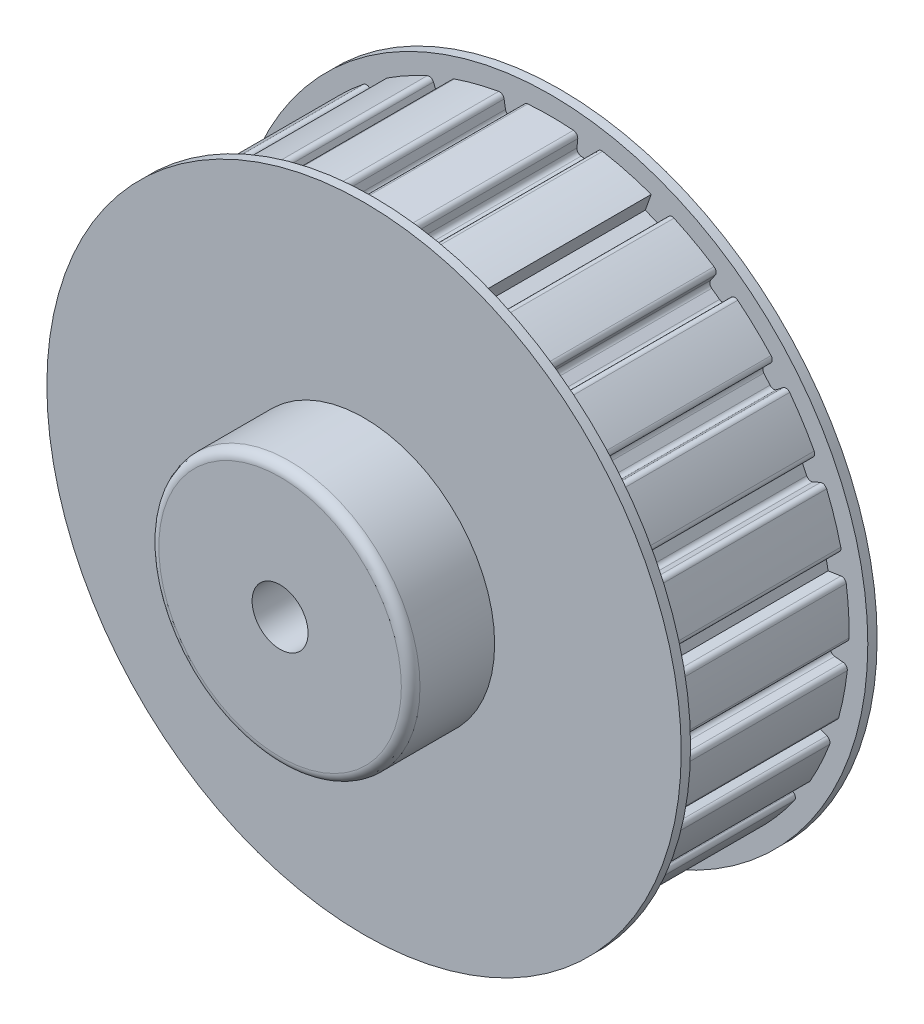
from build123d import *

# Parameters (mm, degrees)
SKETCH1_R               = 34
BOSS_EXTRUDE1_DEPTH     = 1
SKETCH4_R               = 32
BOSS_EXTRUDE2_DEPTH     = 19
CUT_EXTRUDE1_DEPTH      = 19
BOSS_EXTRUDE3_START     = -1
SKETCH9_R               = 34
BOSS_EXTRUDE3_DEPTH     = 1
SKETCH10_R              = 14
BOSS_EXTRUDE4_DEPTH     = 10
CUT_EXTRUDE2_DEPTH      = 53.076866265
CUT_EXTRUDE2_DEPTH_BACK = 53.076866265
SKETCH11_R              = 3
FILLET1_R               = 1
FILLET2_R               = 0.5
FILLET3_R               = 0.5


with BuildPart() as part:
    # Sketch1 → Boss-Extrude1 (new body)
    with BuildSketch(Plane.XY):
        Circle(SKETCH1_R)
    extrude(amount=BOSS_EXTRUDE1_DEPTH)

    # Sketch4 → Boss-Extrude2 (add)
    with BuildSketch(Plane.XY):
        Circle(SKETCH4_R)
    extrude(amount=-BOSS_EXTRUDE2_DEPTH)

    # Sketch8 → Cut-Extrude1 (cut)
    with BuildSketch(Plane.XY.offset(-19)):
        with BuildLine():
            Line((-1, -30.089853456), (-1.066467589, -32.089853456))
            ThreePointArc((-1.066467589, -32.089853456), (0, -32.107569948), (1.066467589, -32.089853456))
            Line((1.066467589, -32.089853456), (1, -30.089853456))
            Line((1, -30.089853456), (-1, -30.089853456))
        make_face()
        with BuildLine():
            Line((6.5144591, -29.393215266), (6.947459487, -31.346911405))
            ThreePointArc((6.947459487, -31.346911405), (7.984827948, -31.098851597), (9.013384583, -30.816471997))
            Line((9.013384583, -30.816471997), (8.451625422, -28.895835492))
            Line((8.451625422, -28.895835492), (6.5144591, -29.393215266))
        make_face()
        with BuildLine():
            Line((13.619590776, -26.84969326), (14.524852132, -28.634327625))
            ThreePointArc((14.524852132, -28.634327625), (15.467939789, -28.136078026), (16.393957476, -27.606778266))
            Line((16.393957476, -27.606778266), (15.372204136, -25.886185911))
            Line((15.372204136, -25.886185911), (13.619590776, -26.84969326))
        make_face()
        with BuildLine():
            Line((19.868953474, -22.619106279), (21.189594899, -24.12254373))
            ThreePointArc((21.189594899, -24.12254373), (21.979144086, -23.405411195), (22.744437728, -22.662449127))
            Line((22.744437728, -22.662449127), (21.326890729, -21.250012068))
            Line((21.326890729, -21.250012068), (19.868953474, -22.619106279))
        make_face()
        with BuildLine():
            Line((24.869876753, -16.967277664), (26.522917489, -18.095051696))
            ThreePointArc((26.522917489, -18.095051696), (27.109317927, -17.2040963), (27.665801309, -16.294154962))
            Line((27.665801309, -16.294154962), (25.941530343, -15.278621813))
            Line((25.941530343, -15.278621813), (24.869876753, -16.967277664))
        make_face()
        with BuildLine():
            Line((28.30813421, -10.249332593), (30.189707628, -10.930581015))
            ThreePointArc((30.189707628, -10.930581015), (30.536113622, -9.921784762), (30.848820846, -8.902039116))
            Line((30.848820846, -8.902039116), (28.926168199, -8.34721956))
            Line((28.926168199, -8.34721956), (28.30813421, -10.249332593))
        make_face()
        with BuildLine():
            Line((29.967687485, -2.88738426), (31.959567407, -3.079301729))
            ThreePointArc((31.959567407, -3.079301729), (32.044212993, -2.016050998), (32.093495515, -0.950575412))
            Line((32.093495515, -0.950575412), (30.093268524, -0.891330803))
            Line((30.093268524, -0.891330803), (29.967687485, -2.88738426))
        make_face()
        with BuildLine():
            Line((29.744260741, 4.655989046), (31.721290027, 4.96546141))
            ThreePointArc((31.721290027, 4.96546141), (31.538856612, 6.016358665), (31.321617829, 7.060616441))
            Line((31.321617829, 7.060616441), (29.369498112, 6.620563547))
            Line((29.369498112, 6.620563547), (29.744260741, 4.655989046))
        make_face()
        with BuildLine():
            Line((27.651892704, 11.906809436), (29.489847331, 12.698226346))
            ThreePointArc((29.489847331, 12.698226346), (29.051797878, 13.670738386), (28.581687703, 14.628163796))
            Line((28.581687703, 14.628163796), (26.800334121, 13.71646354))
            Line((26.800334121, 13.71646354), (27.651892704, 11.906809436))
        make_face()
        with BuildLine():
            Line((23.822054551, 18.409481198), (25.405449072, 19.633115021))
            ThreePointArc((25.405449072, 19.633115021), (24.739307838, 20.466135337), (24.045865022, 21.276569821))
            Line((24.045865022, 21.276569821), (22.547206572, 19.950507684))
            Line((22.547206572, 19.950507684), (23.822054551, 18.409481198))
        make_face()
        with BuildLine():
            Line((18.4953891, 23.755417552), (19.724733013, 25.334382873))
            ThreePointArc((19.724733013, 25.334382873), (18.872356102, 25.975569736), (17.999152207, 26.588090714))
            Line((17.999152207, 26.588090714), (16.877355111, 24.930988057))
            Line((16.877355111, 24.930988057), (18.4953891, 23.755417552))
        make_face()
        with BuildLine():
            Line((12.00659033, 27.608713655), (12.804639436, 29.443798275))
            ThreePointArc((12.804639436, 29.443798275), (11.819584825, 29.852863557), (10.821486463, 30.228984083))
            Line((10.821486463, 30.228984083), (10.147037358, 28.34496276))
            Line((10.147037358, 28.34496276), (12.00659033, 27.608713655))
        make_face()
        with BuildLine():
            Line((4.763373332, 29.727252741), (5.079983271, 31.703151546))
            ThreePointArc((5.079983271, 31.703151546), (4.024145563, 31.854392169), (2.963866925, 31.970479209))
            Line((2.963866925, 31.970479209), (2.77914393, 29.977919208))
            Line((2.77914393, 29.977919208), (4.763373332, 29.727252741))
        make_face()
        with BuildLine():
            Line((-2.77914393, 29.977919208), (-2.963866925, 31.970479209))
            ThreePointArc((-2.963866925, 31.970479209), (-4.024145563, 31.854392169), (-5.079983271, 31.703151546))
            Line((-5.079983271, 31.703151546), (-4.763373332, 29.727252741))
            Line((-4.763373332, 29.727252741), (-2.77914393, 29.977919208))
        make_face()
        with BuildLine():
            Line((-10.147037358, 28.34496276), (-10.821486463, 30.228984083))
            ThreePointArc((-10.821486463, 30.228984083), (-11.819584825, 29.852863557), (-12.804639436, 29.443798275))
            Line((-12.804639436, 29.443798275), (-12.00659033, 27.608713655))
            Line((-12.00659033, 27.608713655), (-10.147037358, 28.34496276))
        make_face()
        with BuildLine():
            Line((-16.877355111, 24.930988057), (-17.999152207, 26.588090714))
            ThreePointArc((-17.999152207, 26.588090714), (-18.872356102, 25.975569736), (-19.724733013, 25.334382873))
            Line((-19.724733013, 25.334382873), (-18.4953891, 23.755417552))
            Line((-18.4953891, 23.755417552), (-16.877355111, 24.930988057))
        make_face()
        with BuildLine():
            Line((-22.547206572, 19.950507684), (-24.045865022, 21.276569821))
            ThreePointArc((-24.045865022, 21.276569821), (-24.739307838, 20.466135337), (-25.405449072, 19.633115021))
            Line((-25.405449072, 19.633115021), (-23.822054551, 18.409481198))
            Line((-23.822054551, 18.409481198), (-22.547206572, 19.950507684))
        make_face()
        with BuildLine():
            Line((-26.800334121, 13.71646354), (-28.581687703, 14.628163796))
            ThreePointArc((-28.581687703, 14.628163796), (-29.051797878, 13.670738386), (-29.489847331, 12.698226346))
            Line((-29.489847331, 12.698226346), (-27.651892704, 11.906809436))
            Line((-27.651892704, 11.906809436), (-26.800334121, 13.71646354))
        make_face()
        with BuildLine():
            Line((-29.369498112, 6.620563547), (-31.321617829, 7.060616441))
            ThreePointArc((-31.321617829, 7.060616441), (-31.538856612, 6.016358665), (-31.721290027, 4.96546141))
            Line((-31.721290027, 4.96546141), (-29.744260741, 4.655989046))
            Line((-29.744260741, 4.655989046), (-29.369498112, 6.620563547))
        make_face()
        with BuildLine():
            Line((-30.093268524, -0.891330803), (-32.093495515, -0.950575412))
            ThreePointArc((-32.093495515, -0.950575412), (-32.044212993, -2.016050998), (-31.959567407, -3.079301729))
            Line((-31.959567407, -3.079301729), (-29.967687485, -2.88738426))
            Line((-29.967687485, -2.88738426), (-30.093268524, -0.891330803))
        make_face()
        with BuildLine():
            Line((-28.926168199, -8.34721956), (-30.848820846, -8.902039116))
            ThreePointArc((-30.848820846, -8.902039116), (-30.536113622, -9.921784762), (-30.189707628, -10.930581015))
            Line((-30.189707628, -10.930581015), (-28.30813421, -10.249332593))
            Line((-28.30813421, -10.249332593), (-28.926168199, -8.34721956))
        make_face()
        with BuildLine():
            Line((-25.941530343, -15.278621813), (-27.665801309, -16.294154962))
            ThreePointArc((-27.665801309, -16.294154962), (-27.109317927, -17.2040963), (-26.522917489, -18.095051696))
            Line((-26.522917489, -18.095051696), (-24.869876753, -16.967277664))
            Line((-24.869876753, -16.967277664), (-25.941530343, -15.278621813))
        make_face()
        with BuildLine():
            Line((-21.326890729, -21.250012068), (-22.744437728, -22.662449127))
            ThreePointArc((-22.744437728, -22.662449127), (-21.979144086, -23.405411195), (-21.189594899, -24.12254373))
            Line((-21.189594899, -24.12254373), (-19.868953474, -22.619106279))
            Line((-19.868953474, -22.619106279), (-21.326890729, -21.250012068))
        make_face()
        with BuildLine():
            Line((-15.372204136, -25.886185911), (-16.393957476, -27.606778266))
            ThreePointArc((-16.393957476, -27.606778266), (-15.467939789, -28.136078026), (-14.524852132, -28.634327625))
            Line((-14.524852132, -28.634327625), (-13.619590776, -26.84969326))
            Line((-13.619590776, -26.84969326), (-15.372204136, -25.886185911))
        make_face()
        with BuildLine():
            Line((-8.451625422, -28.895835492), (-9.013384583, -30.816471997))
            ThreePointArc((-9.013384583, -30.816471997), (-7.984827948, -31.098851597), (-6.947459487, -31.346911405))
            Line((-6.947459487, -31.346911405), (-6.5144591, -29.393215266))
            Line((-6.5144591, -29.393215266), (-8.451625422, -28.895835492))
        make_face()
    extrude(amount=CUT_EXTRUDE1_DEPTH, mode=Mode.SUBTRACT)

    # Sketch9 → Boss-Extrude3 (add)
    with BuildSketch(Plane.XY.offset(-19).offset(BOSS_EXTRUDE3_START)):
        Circle(SKETCH9_R)
    extrude(amount=BOSS_EXTRUDE3_DEPTH)

    # Sketch10 → Boss-Extrude4 (add)
    with BuildSketch(Plane.XY):
        Circle(SKETCH10_R)
    extrude(amount=BOSS_EXTRUDE4_DEPTH)

    # Sketch11 → Cut-Extrude2 (cut, two sides: drawn at the far end of the back side and taken through both)
    with BuildSketch(Plane.XY.offset(-CUT_EXTRUDE2_DEPTH_BACK)):
        Circle(SKETCH11_R)
    extrude(amount=CUT_EXTRUDE2_DEPTH + CUT_EXTRUDE2_DEPTH_BACK, mode=Mode.SUBTRACT)

    # Fillet1
    fillet1_edges = [part.edges().sort_by_distance(p)[0] for p in [
        (-14, 0, 10),
    ]]
    fillet(fillet1_edges, radius=FILLET1_R)

    # Fillet2
    fillet2_edges = [part.edges().sort_by_distance(p)[0] for p in [
        (1.062894604, -31.982342864, -9.5),
        (1, -30.089853456, -9.5),
        (-1.062894604, -31.982342864, -9.5),
        (-1, -30.089853456, -9.5),
        (2.77914393, 29.977919208, -9.5),
        (5.06296381, 31.59693652, -9.5),
        (4.763373332, 29.727252741, -9.5),
        (2.953937086, 31.863368555, -9.5),
        (-4.763373332, 29.727252741, -9.5),
        (-2.953937086, 31.863368555, -9.5),
        (-5.06296381, 31.59693652, -9.5),
        (-12.00659033, 27.608713655, -9.5),
        (-10.785231251, 30.127707959, -9.5),
        (-10.147037358, 28.34496276, -9.5),
        (-12.76174007, 29.345152758, -9.5),
        (-18.4953891, 23.755417552, -9.5),
        (-17.938849672, 26.49901267, -9.5),
        (-16.877355111, 24.930988057, -9.5),
        (-19.658649267, 25.249505124, -9.5),
        (-23.822054551, 18.409481198, -9.5),
        (-23.965304193, 21.205286958, -9.5),
        (-22.547206572, 19.950507684, -9.5),
        (-25.320333231, 19.567338222, -9.5),
        (-27.651892704, 11.906809436, -9.5),
        (-28.485930513, 14.579155078, -9.5),
        (-26.800334121, 13.71646354, -9.5),
        (-29.391047536, 12.655683496, -9.5),
        (-29.744260741, 4.655989046, -9.5),
        (-31.216681056, 7.036961267, -9.5),
        (-29.369498112, 6.620563547, -9.5),
        (-31.615014232, 4.948825631, -9.5),
        (-29.967687485, -2.88738426, -9.5),
        (-31.98597272, -0.9473907, -9.5),
        (-30.093268524, -0.891330803, -9.5),
        (-31.852493312, -3.068985148, -9.5),
        (-28.30813421, -10.249332593, -9.5),
        (-30.745468083, -8.872214626, -9.5),
        (-28.926168199, -8.34721956, -9.5),
        (-30.088563091, -10.893960304, -9.5),
        (-24.869876753, -16.967277664, -9.5),
        (-27.573112612, -16.239564677, -9.5),
        (-25.941530343, -15.278621813, -9.5),
        (-26.434057794, -18.034427868, -9.5),
        (-19.868953474, -22.619106279, -9.5),
        (-22.668237069, -22.586523154, -9.5),
        (-21.326890729, -21.250012068, -9.5),
        (-21.118603428, -24.041726004, -9.5),
        (-13.619590776, -26.84969326, -9.5),
        (-16.339032822, -27.514287315, -9.5),
        (-15.372204136, -25.886185911, -9.5),
        (-14.47618954, -28.538394076, -9.5),
        (-6.5144591, -29.393215266, -9.5),
        (-8.983187053, -30.713227612, -9.5),
        (-8.451625422, -28.895835492, -9.5),
        (-6.924183423, -31.24188989, -9.5),
    ]]
    fillet(fillet2_edges, radius=FILLET2_R)

    # Fillet3
    fillet3_edges = [part.edges().sort_by_distance(p)[0] for p in [
        (15.372204136, -25.886185911, -9.5),
        (16.339032822, -27.514287315, -9.5),
        (21.326890729, -21.250012068, -9.5),
        (21.118603428, -24.041726004, -9.5),
        (19.868953474, -22.619106279, -9.5),
        (22.668237069, -22.586523154, -9.5),
        (25.941530343, -15.278621813, -9.5),
        (26.434057794, -18.034427868, -9.5),
        (24.869876753, -16.967277664, -9.5),
        (27.573112612, -16.239564677, -9.5),
        (28.926168199, -8.34721956, -9.5),
        (30.088563091, -10.893960304, -9.5),
        (28.30813421, -10.249332593, -9.5),
        (30.745468083, -8.872214626, -9.5),
        (30.093268524, -0.891330803, -9.5),
        (31.852493312, -3.068985148, -9.5),
        (29.967687485, -2.88738426, -9.5),
        (31.98597272, -0.9473907, -9.5),
        (31.615014232, 4.948825631, -9.5),
        (31.216681056, 7.036961267, -9.5),
        (26.800334121, 13.71646354, -9.5),
        (29.391047536, 12.655683496, -9.5),
        (27.651892704, 11.906809436, -9.5),
        (28.485930513, 14.579155078, -9.5),
        (22.547206572, 19.950507684, -9.5),
        (25.320333231, 19.567338222, -9.5),
        (23.822054551, 18.409481198, -9.5),
        (23.965304193, 21.205286958, -9.5),
        (16.877355111, 24.930988057, -9.5),
        (19.658649267, 25.249505124, -9.5),
        (18.4953891, 23.755417552, -9.5),
        (17.938849672, 26.49901267, -9.5),
        (12.76174007, 29.345152758, -9.5),
        (12.00659033, 27.608713655, -9.5),
        (8.451625422, -28.895835492, -9.5),
        (6.924183423, -31.24188989, -9.5),
        (6.5144591, -29.393215266, -9.5),
        (8.983187053, -30.713227612, -9.5),
    ]]
    fillet(fillet3_edges, radius=FILLET3_R)


solid = part.part
